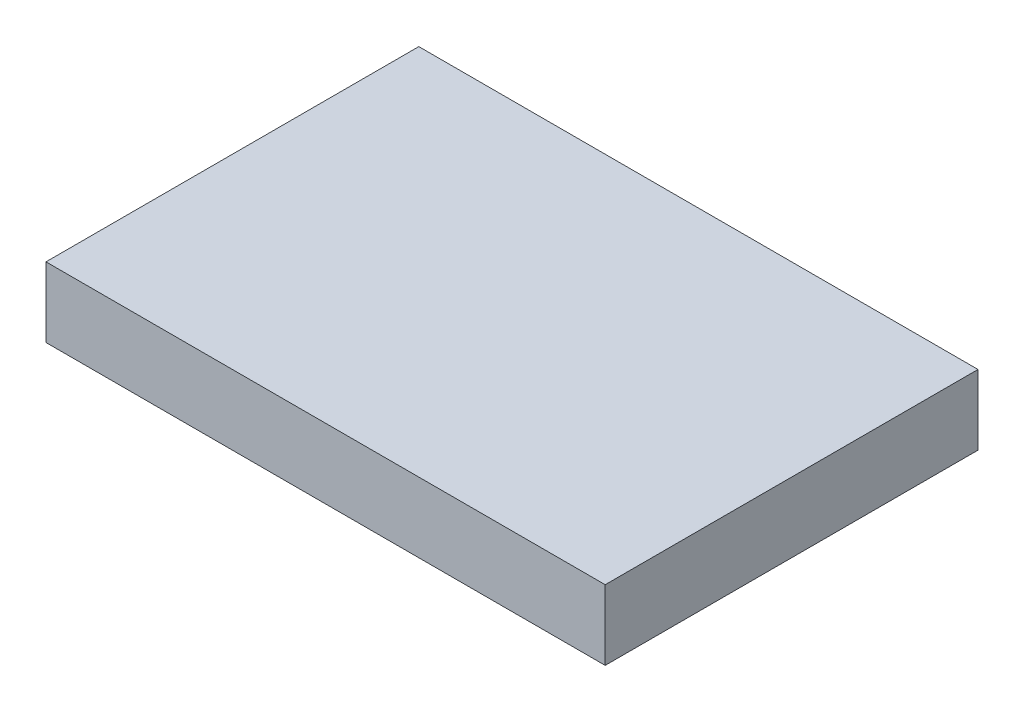
from build123d import *

# Parameters (mm, degrees)
SKETCH_1_W      = 120
SKETCH_1_H      = 80
EXTRUDE_1_DEPTH = 15


with BuildPart() as part:
    # 草图1 → 凸台-拉伸1 (new body)
    with BuildSketch(Plane(origin=(0, 0, 0), x_dir=(1, 0, 0), z_dir=(0, 1, 0))):
        Rectangle(SKETCH_1_W, SKETCH_1_H)
    extrude(amount=-EXTRUDE_1_DEPTH)


solid = part.part
